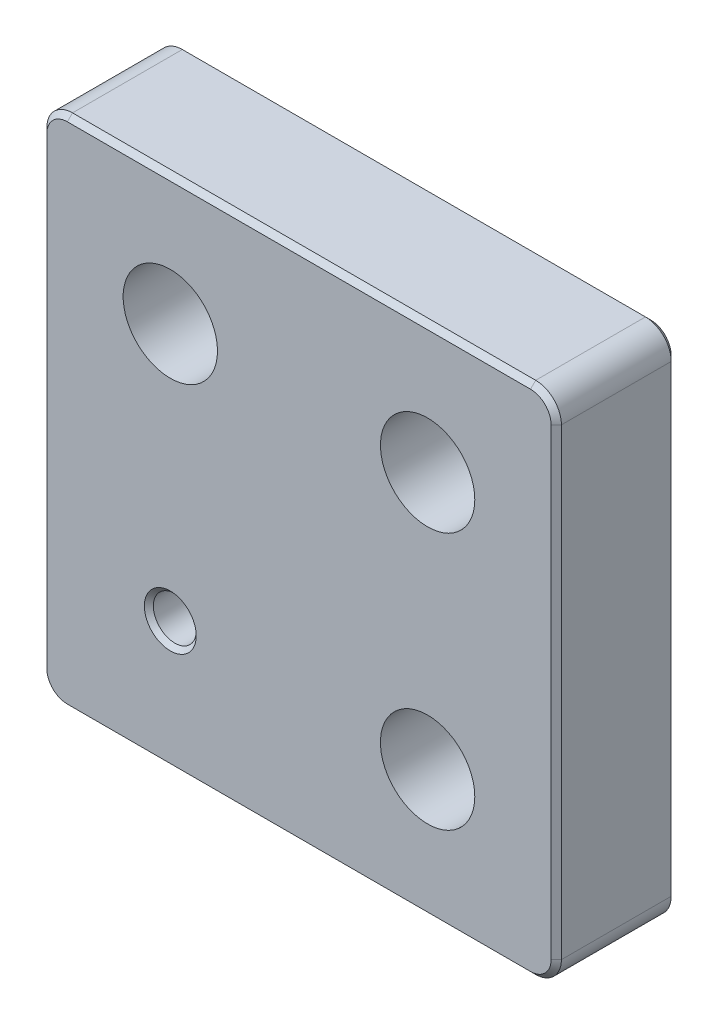
from build123d import *

# Parameters (mm, degrees)
SKETCH1_W                                           = 60
SKETCH1_H                                           = 60
BOSS_EXTRUDE1_DEPTH                                 = 14
CBORE_FOR_M6_HEX_SOCKET_HEAD_CAP_SCREW1_D           = 6.5
CBORE_FOR_M6_HEX_SOCKET_HEAD_CAP_SCREW1_CBORE_D     = 11
CBORE_FOR_M6_HEX_SOCKET_HEAD_CAP_SCREW1_CBORE_DEPTH = 8
M6_TAPPED_HOLE1_D                                   = 5
M6_TAPPED_HOLE1_CSINK_D                             = 6.05
M6_TAPPED_HOLE1_CSINK_ANGLE                         = 90
FILLET1_R                                           = 3
CHAMFER1_SIZE                                       = 0.6


with BuildPart() as part:
    # Sketch1 → Boss-Extrude1 (new body)
    with BuildSketch(Plane.XY):
        Rectangle(SKETCH1_W, SKETCH1_H)
    extrude(amount=BOSS_EXTRUDE1_DEPTH)

    # CBORE for M6 Hex Socket Head Cap Screw1 (through all)
    with Locations(Plane.XY.offset(14)):
        with Locations((-15, 15), (15, 15), (15, -15)):
            CounterBoreHole(CBORE_FOR_M6_HEX_SOCKET_HEAD_CAP_SCREW1_D / 2, CBORE_FOR_M6_HEX_SOCKET_HEAD_CAP_SCREW1_CBORE_D / 2, CBORE_FOR_M6_HEX_SOCKET_HEAD_CAP_SCREW1_CBORE_DEPTH)

    # M6 Tapped Hole1 (through all)
    with Locations(Plane.XY.offset(14)):
        with Locations((-15, -15)):
            CounterSinkHole(M6_TAPPED_HOLE1_D / 2, M6_TAPPED_HOLE1_CSINK_D / 2, counter_sink_angle=M6_TAPPED_HOLE1_CSINK_ANGLE)

    # Fillet1
    fillet1_edges = [part.edges().sort_by_distance(p)[0] for p in [
        (-30, 30, 7),
        (30, 30, 7),
        (30, -30, 7),
        (-30, -30, 7),
    ]]
    fillet(fillet1_edges, radius=FILLET1_R)

    # Chamfer1
    chamfer1_edges = [part.edges().sort_by_distance(p)[0] for p in [
        (-30, 0, 0),
        (-30, 0, 14),
        (0, 30, 0),
        (30, 0, 0),
        (0, -30, 0),
        (-29.121320344, -29.121320344, 0),
        (29.121320344, -29.121320344, 0),
        (29.121320344, 29.121320344, 0),
        (-29.121320344, 29.121320344, 0),
        (0, 30, 14),
        (0, -30, 14),
        (30, 0, 14),
        (-29.121320344, -29.121320344, 14),
        (29.121320344, -29.121320344, 14),
        (29.121320344, 29.121320344, 14),
        (-29.121320344, 29.121320344, 14),
    ]]
    chamfer(chamfer1_edges, length=CHAMFER1_SIZE)


solid = part.part
